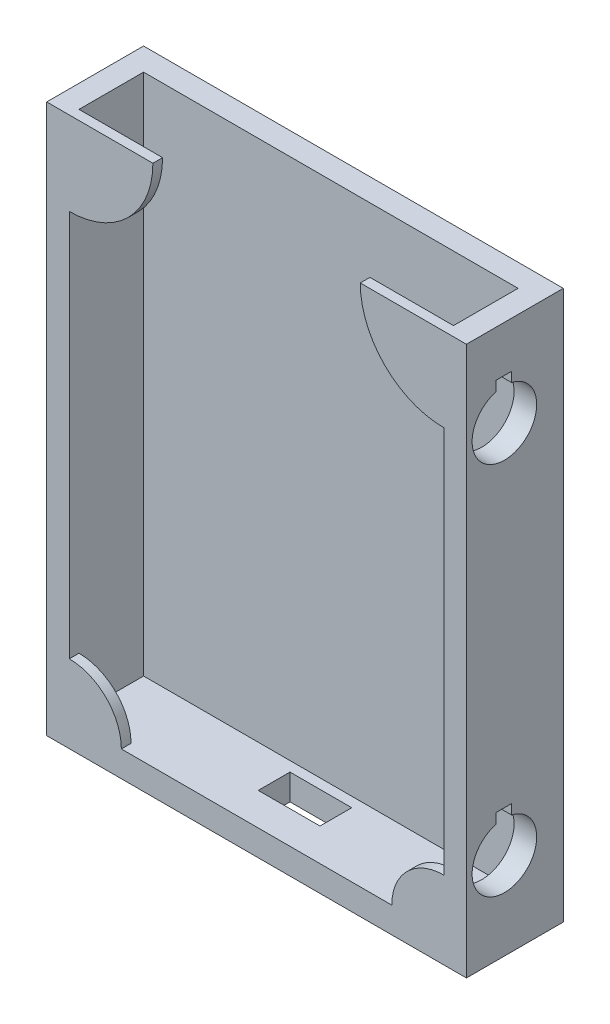
from build123d import *

# Parameters (mm, degrees)
ESQUISSE1_W             = 65
ESQUISSE1_H             = 85
BOSS_EXTRU_1_DEPTH      = 15
ESQUISSE2_W             = 58
ESQUISSE2_H             = 60
ENL_V_MAT_EXTRU_1_DEPTH = 11.5
ENL_V_MAT_EXTRU_2_DEPTH = 11.5
ESQUISSE5_W             = 12.942434053
ESQUISSE5_H             = 10
ENL_V_MAT_EXTRU_4_DEPTH = 81
ESQUISSE6_W             = 12.942434052
ESQUISSE6_H             = 10
ENL_V_MAT_EXTRU_5_DEPTH = 81
ESQUISSE7_W             = 9.561184164
ESQUISSE7_H             = 4.914624062
ENL_V_MAT_EXTRU_6_DEPTH = 81
ESQUISSE9_W             = 27
ESQUISSE9_H             = 15
BOSS_EXTRU_3_DEPTH      = 4
ENL_V_MAT_EXTRU_8_DEPTH = 4
ESQUISSE13_R            = 5
ESQUISSE13_W            = 2.4
ESQUISSE13_H            = 6.4
ENL_V_MAT_EXTRU_9_DEPTH = 4


with BuildPart() as part:
    # Esquisse1 → Boss.-Extru.1 (new body)
    with BuildSketch(Plane.XY):
        with Locations((-47.785104755, -14.386514523)):
            Rectangle(ESQUISSE1_W, ESQUISSE1_H)
    extrude(amount=BOSS_EXTRU_1_DEPTH)

    # Esquisse2 → Enlèv. mat.-Extru.1 (cut)
    with BuildSketch(Plane.XY.offset(15)):
        with Locations((-47.785104755, -14.828948576)):
            Rectangle(ESQUISSE2_W, ESQUISSE2_H)
    extrude(amount=-ENL_V_MAT_EXTRU_1_DEPTH, mode=Mode.SUBTRACT)

    # Esquisse3 → Enlèv. mat.-Extru.2 (cut)
    with BuildSketch(Plane.XY.offset(15)):
        with BuildLine():
            Line((-31.727538807, 28.113485477), (-63.842670702, 28.113485477))
            ThreePointArc((-63.842670702, 28.113485477), (-67.633421871, 18.961802593), (-76.785104755, 15.171051424))
            Line((-76.785104755, 15.171051424), (-18.785104755, 15.171051424))
            ThreePointArc((-18.785104755, 15.171051424), (-27.936787638, 18.961802593), (-31.727538807, 28.113485477))
        make_face()
        with BuildLine():
            ThreePointArc((-18.785104755, -44.828948576), (-24.482664276, -47.188955002), (-26.842670702, -52.886514523))
            Line((-26.842670702, -52.886514523), (-68.727538807, -52.886514523))
            ThreePointArc((-68.727538807, -52.886514523), (-71.087545234, -47.188955002), (-76.785104755, -44.828948576))
            Line((-76.785104755, -44.828948576), (-18.785104755, -44.828948576))
        make_face()
    extrude(amount=-ENL_V_MAT_EXTRU_2_DEPTH, mode=Mode.SUBTRACT)

    # Esquisse5 → Enlèv. mat.-Extru.4 (cut)
    with BuildSketch(Plane(origin=(0, 28.113485477, 0), x_dir=(1, 0, 0), z_dir=(0, 1, 0))):
        with Locations((-70.313887729, -8.5)):
            Rectangle(ESQUISSE5_W, ESQUISSE5_H)
    extrude(amount=-ENL_V_MAT_EXTRU_4_DEPTH, mode=Mode.SUBTRACT)

    # Esquisse6 → Enlèv. mat.-Extru.5 (cut)
    with BuildSketch(Plane(origin=(0, 28.113485477, 0), x_dir=(1, 0, 0), z_dir=(0, 1, 0))):
        with Locations((-25.256321781, -8.5)):
            Rectangle(ESQUISSE6_W, ESQUISSE6_H)
    extrude(amount=-ENL_V_MAT_EXTRU_5_DEPTH, mode=Mode.SUBTRACT)

    # Esquisse7 → Enlèv. mat.-Extru.6 (cut)
    with BuildSketch(Plane(origin=(0, -56.886514523, 0), x_dir=(-1, 0, 0), z_dir=(0, -1, 0))):
        with Locations((47.785104755, -7.5)):
            Rectangle(ESQUISSE7_W, ESQUISSE7_H)
    extrude(amount=-ENL_V_MAT_EXTRU_6_DEPTH, mode=Mode.SUBTRACT)

    # Esquisse9 → Boss.-Extru.3 (add)
    with BuildSketch(Plane(origin=(0, 0, 0), x_dir=(-1, 0, 0), z_dir=(0, 0, -1))):
        with Locations((47.785104755, 7.665180304)):
            Rectangle(ESQUISSE9_W, ESQUISSE9_H)
    extrude(amount=BOSS_EXTRU_3_DEPTH)

    # Esquisse10 → Enlèv. mat.-Extru.8 (cut)
    with BuildSketch(Plane(origin=(0, 0, -4), x_dir=(-1, 0, 0), z_dir=(0, 0, -1))):
        Polygon((42.785104755, 15.165180304), (44.785104755, 6.365180304), (36.285104755, 6.365180304), (38.285104755, 15.165180304), align=None)
        Polygon((52.785104755, 15.165180304), (50.785104755, 6.365180304), (59.285104755, 6.365180304), (57.285104755, 15.165180304), align=None)
    extrude(amount=-ENL_V_MAT_EXTRU_8_DEPTH, mode=Mode.SUBTRACT)

    # Esquisse13 → Enlèv. mat.-Extru.9 (cut)
    with BuildSketch(Plane(origin=(-15.285104755, 0, 0), x_dir=(0, 0, -1), z_dir=(1, 0, 0))):
        with Locations((-9.118338435, 14.613485477)):
            Circle(ESQUISSE13_R)
        with Locations((-9.118338435, -43.386514523)):
            Circle(ESQUISSE13_R)
        with Locations((-9.218338435, 17.790714068)):
            Rectangle(ESQUISSE13_W, ESQUISSE13_H)
        with Locations((-9.218338435, -40.186514523)):
            Rectangle(ESQUISSE13_W, ESQUISSE13_H)
    extrude(amount=-ENL_V_MAT_EXTRU_9_DEPTH, mode=Mode.SUBTRACT)


solid = part.part
